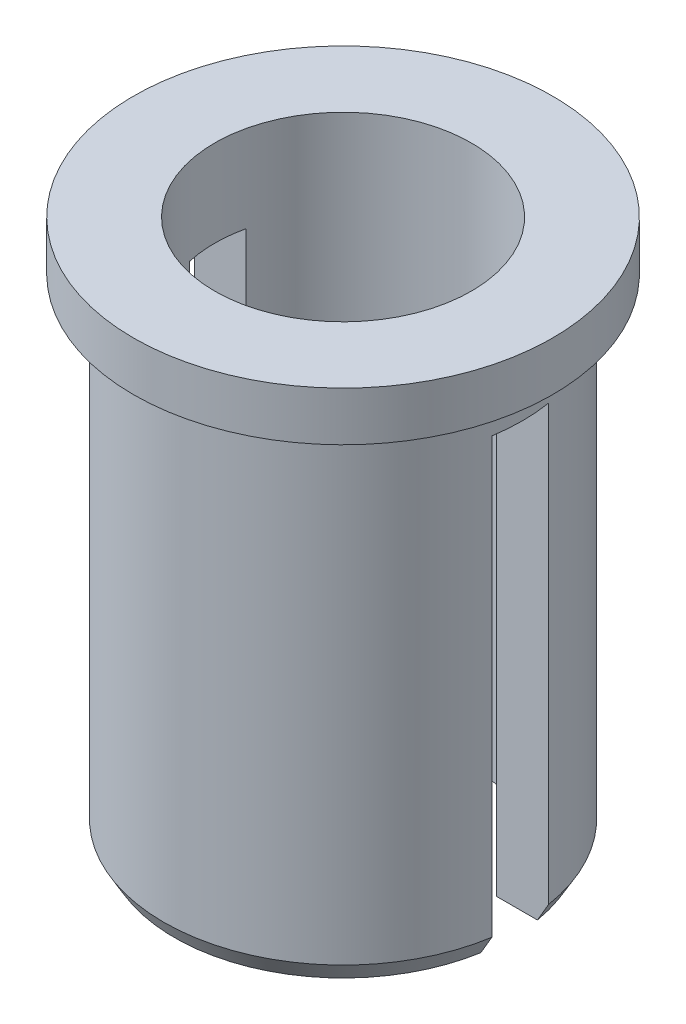
from build123d import *

# Parameters (mm, degrees)
TAPPED_HOLE1_D     = 6.8
SKETCH4_W          = 9.5
SKETCH4_H          = 1.5
CUT_EXTRUDE1_DEPTH = 12


with BuildPart() as part:
    # Sketch1 → Revolve1 (revolve)
    with BuildSketch(Plane(origin=(0, 0, 0), x_dir=(0, 0, -1), z_dir=(1, 0, 0))):
        Polygon((-4.75, -13.8), (-4.75, -1.4), (-4.65, -1.4), (-4.65, -1.3), (-5.55, -1.3), (-5.55, 0), (-3.25, 0), (-3.25, -14.3), (-4.461324865, -14.3), align=None)
    revolve(axis=Axis((0, 0, 0), (0, -1, 0)))

    # Tapped Hole1 (through all)
    with Locations(Plane(origin=(0, 0, 0), x_dir=(1, 0, 0), z_dir=(0, 1, 0))):
        with Locations((0, 0)):
            Hole(TAPPED_HOLE1_D / 2)

    # Sketch4 → Cut-Extrude1 (cut)
    with BuildSketch(Plane.XZ.offset(14.3)):
        Rectangle(SKETCH4_W, SKETCH4_H)
    extrude(amount=-CUT_EXTRUDE1_DEPTH, mode=Mode.SUBTRACT)


solid = part.part
